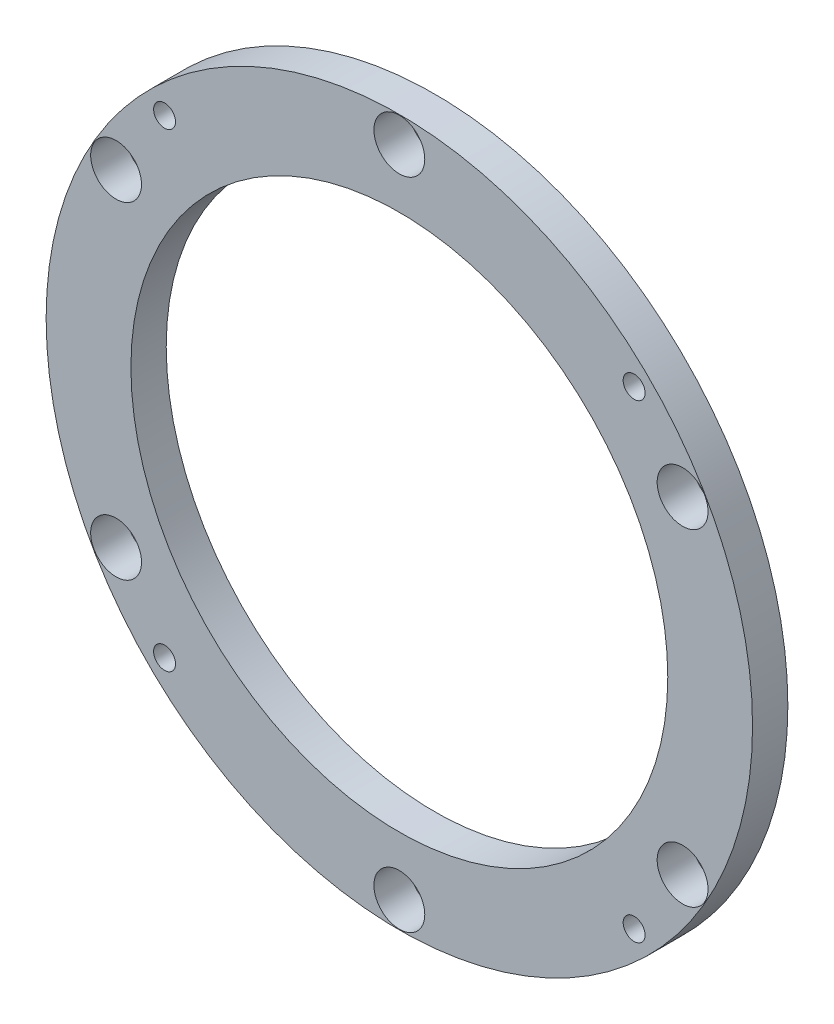
from build123d import *

# Parameters (mm, degrees)
ESQUISSE1_R        = 50
ESQUISSE1_R_2      = 3.6
ESQUISSE1_R_3      = 2.05
ESQUISSE1_R_4      = 1.55
BOSS_EXTRU_1_DEPTH = 5
SKETCH4_R          = 38
CUT_EXTRUDE3_DEPTH = 10


with BuildPart() as part:
    # Esquisse1 → Boss.-Extru.1 (new body)
    with BuildSketch(Plane.XY):
        Circle(ESQUISSE1_R)
        with Locations((-40.096976195, -23.15)):
            Circle(ESQUISSE1_R_2, mode=Mode.SUBTRACT)
        with Locations((-40.096976195, 23.15)):
            Circle(ESQUISSE1_R_2, mode=Mode.SUBTRACT)
        with Locations((0, 46.3)):
            Circle(ESQUISSE1_R_2, mode=Mode.SUBTRACT)
        with Locations((40.096976195, 23.15)):
            Circle(ESQUISSE1_R_2, mode=Mode.SUBTRACT)
        with Locations((40.096976195, -23.15)):
            Circle(ESQUISSE1_R_2, mode=Mode.SUBTRACT)
        with Locations((0, -46.3)):
            Circle(ESQUISSE1_R_2, mode=Mode.SUBTRACT)
        with Locations((0, 19.165334425)):
            Circle(ESQUISSE1_R_3, mode=Mode.SUBTRACT)
        with Locations((0, -19.232757636)):
            Circle(ESQUISSE1_R_3, mode=Mode.SUBTRACT)
        with Locations((-33.234018716, 33.234018716)):
            Circle(ESQUISSE1_R_4, mode=Mode.SUBTRACT)
        with Locations((33.234018716, 33.234018716)):
            Circle(ESQUISSE1_R_4, mode=Mode.SUBTRACT)
        with Locations((33.234018716, -33.234018716)):
            Circle(ESQUISSE1_R_4, mode=Mode.SUBTRACT)
        with Locations((-33.234018716, -33.234018716)):
            Circle(ESQUISSE1_R_4, mode=Mode.SUBTRACT)
        with Locations((-16.671397033, -9.625235564)):
            Circle(ESQUISSE1_R_3, mode=Mode.SUBTRACT)
        with Locations((16.669571796, 9.624181764)):
            Circle(ESQUISSE1_R_3, mode=Mode.SUBTRACT)
        with Locations((-16.671397032, 9.625235564)):
            Circle(ESQUISSE1_R_3, mode=Mode.SUBTRACT)
        with Locations((16.666666667, -9.622504487)):
            Circle(ESQUISSE1_R_3, mode=Mode.SUBTRACT)
    extrude(amount=BOSS_EXTRU_1_DEPTH)

    # Sketch4 → Cut-Extrude3 (cut)
    with BuildSketch(Plane(origin=(0, 0, 0), x_dir=(-1, 0, 0), z_dir=(0, 0, -1))):
        Circle(SKETCH4_R)
    extrude(amount=-CUT_EXTRUDE3_DEPTH, mode=Mode.SUBTRACT)


solid = part.part
